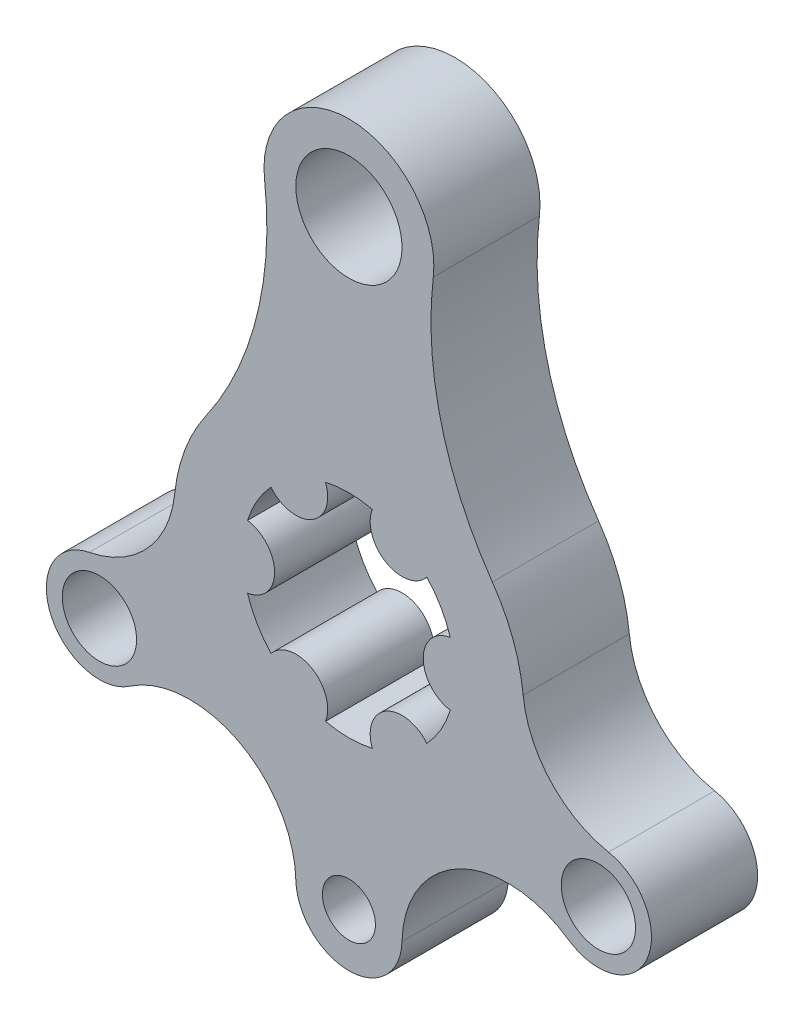
from build123d import *

# Parameters (mm, degrees)
BOSS_EXTRUDE1_DEPTH = 20
SKETCH3_R           = 10
SKETCH3_R_2         = 7
SKETCH3_R_3         = 5
CUT_EXTRUDE1_DEPTH  = 102.044544633


with BuildPart() as part:
    # Sketch2 → Boss-Extrude1 (new body)
    with BuildSketch(Plane.XY):
        with BuildLine():
            ThreePointArc((32.82507564, 3.393288852), (30.919385889, 11.532197372), (27.029816197, 18.931165741))
            ThreePointArc((27.029816197, 18.931165741), (17.392020832, 40.004906757), (15.890255583, 63.129230769))
            ThreePointArc((15.890255583, 63.129230769), (0, 81), (-15.890255583, 63.129230769))
            ThreePointArc((-15.890255583, 63.129230769), (-17.392020832, 40.004906757), (-27.029816197, 18.931165741))
            ThreePointArc((-27.029816197, 18.931165741), (-30.919385889, 11.532197372), (-32.82507564, 3.393288852))
            ThreePointArc((-32.82507564, 3.393288852), (-37.963155814, -8.050663767), (-48.906353625, -14.183390817))
            ThreePointArc((-48.906353625, -14.183390817), (-56.22107819, -27.869330305), (-41.330511904, -32.237530257))
            ThreePointArc((-41.330511904, -32.237530257), (-20.895992582, -30.900485472), (-9.997178571, -48.237530257))
            ThreePointArc((-9.997178571, -48.237530257), (0, -58), (9.997178571, -48.237530257))
            ThreePointArc((9.997178571, -48.237530257), (20.895992582, -30.900485472), (41.330511904, -32.237530257))
            ThreePointArc((41.330511904, -32.237530257), (56.22107819, -27.869330305), (48.906353625, -14.183390817))
            ThreePointArc((48.906353625, -14.183390817), (37.963155814, -8.050663767), (32.82507564, 3.393288852))
        make_face()
    extrude(amount=-BOSS_EXTRUDE1_DEPTH)

    # Sketch3 → Cut-Extrude1 (cut, through all)
    with BuildSketch(Plane(origin=(0, 0, -20), x_dir=(-1, 0, 0), z_dir=(0, 0, -1))):
        with Locations((0, 65)):
            Circle(SKETCH3_R)
        with Locations((47, -24)):
            Circle(SKETCH3_R_2)
        with Locations((0, -48)):
            Circle(SKETCH3_R_3)
        with Locations((-47, -24)):
            Circle(SKETCH3_R_2)
        with BuildLine():
            ThreePointArc((-14.687363137, 13.575027222), (-17.320508076, 10), (-19.1, 5.93211598))
            ThreePointArc((-19.1, 5.93211598), (-14, 0), (-19.1, -5.93211598))
            ThreePointArc((-19.1, -5.93211598), (-17.320508076, -10), (-14.687363137, -13.575027222))
            ThreePointArc((-14.687363137, -13.575027222), (-7, -12.124355653), (-4.412636863, -19.507143202))
            ThreePointArc((-4.412636863, -19.507143202), (0, -20), (4.412636863, -19.507143202))
            ThreePointArc((4.412636863, -19.507143202), (7, -12.124355653), (14.687363137, -13.575027222))
            ThreePointArc((14.687363137, -13.575027222), (17.320508076, -10), (19.1, -5.93211598))
            ThreePointArc((19.1, -5.93211598), (14, 0), (19.1, 5.93211598))
            ThreePointArc((19.1, 5.93211598), (17.320508076, 10), (14.687363137, 13.575027222))
            ThreePointArc((14.687363137, 13.575027222), (7, 12.124355653), (4.412636863, 19.507143202))
            ThreePointArc((4.412636863, 19.507143202), (0, 20), (-4.412636863, 19.507143202))
            ThreePointArc((-4.412636863, 19.507143202), (-7, 12.124355653), (-14.687363137, 13.575027222))
        make_face()
    extrude(amount=-CUT_EXTRUDE1_DEPTH, mode=Mode.SUBTRACT)


solid = part.part
